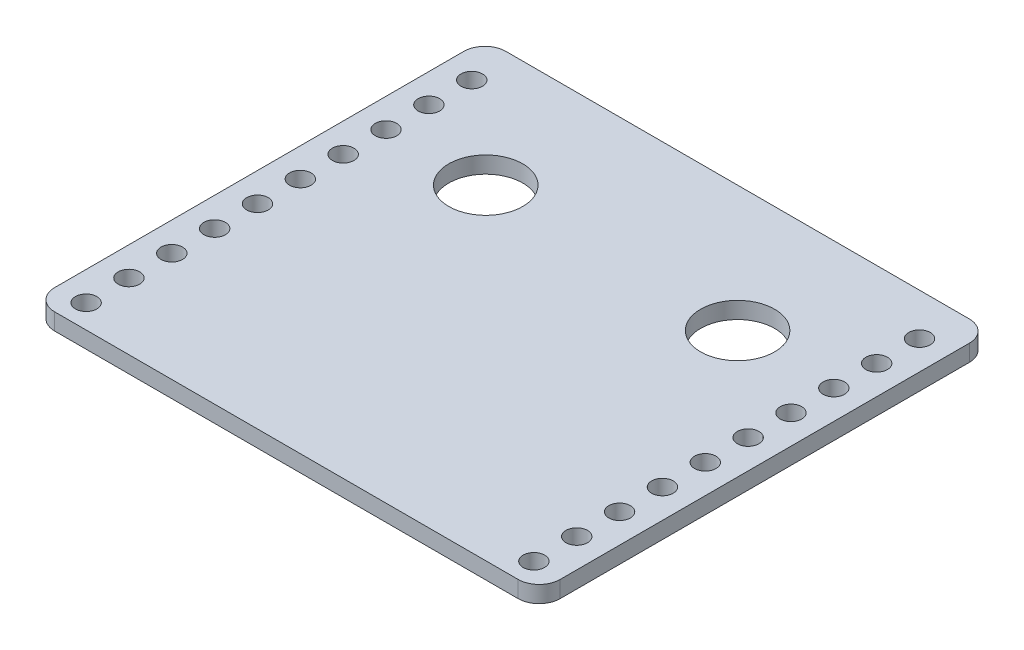
from build123d import *

# Parameters (mm, degrees)
SKETCH1_W           = 96.35
SKETCH1_H           = 86
SKETCH1_R           = 2.05
BOSS_EXTRUDE1_DEPTH = 3.175
FILLET1_R           = 4
SKETCH2_R           = 7.05
CUT_EXTRUDE1_DEPTH  = 3.18


with BuildPart() as part:
    # Sketch1 → Boss-Extrude1 (new body)
    with BuildSketch(Plane(origin=(0, 0, 0), x_dir=(1, 0, 0), z_dir=(0, 1, 0))):
        Rectangle(SKETCH1_W, SKETCH1_H)
        with Locations(Location((42.675, 35, 0), (0, 0, 270))):
            Circle(SKETCH1_R, mode=Mode.SUBTRACT)
        with Locations(Location((42.675, 26.832661921, 0), (0, 0, 270))):
            Circle(SKETCH1_R, mode=Mode.SUBTRACT)
        with Locations(Location((42.675, 18.665323842, 0), (0, 0, 270))):
            Circle(SKETCH1_R, mode=Mode.SUBTRACT)
        with Locations(Location((42.675, 10.497985763, 0), (0, 0, 270))):
            Circle(SKETCH1_R, mode=Mode.SUBTRACT)
        with Locations(Location((42.675, 2.330647684, 0), (0, 0, 270))):
            Circle(SKETCH1_R, mode=Mode.SUBTRACT)
        with Locations(Location((42.675, -5.836690395, 0), (0, 0, 270))):
            Circle(SKETCH1_R, mode=Mode.SUBTRACT)
        with Locations(Location((42.675, -14.004028475, 0), (0, 0, 270))):
            Circle(SKETCH1_R, mode=Mode.SUBTRACT)
        with Locations(Location((42.675, -22.171366554, 0), (0, 0, 270))):
            Circle(SKETCH1_R, mode=Mode.SUBTRACT)
        with Locations(Location((42.675, -30.338704633, 0), (0, 0, 270))):
            Circle(SKETCH1_R, mode=Mode.SUBTRACT)
        with Locations(Location((42.675, -38.506042712, 0), (0, 0, 270))):
            Circle(SKETCH1_R, mode=Mode.SUBTRACT)
        with Locations(Location((-42.675, -38.506042712, 0), (0, 0, 90))):
            Circle(SKETCH1_R, mode=Mode.SUBTRACT)
        with Locations(Location((-42.675, -30.338704633, 0), (0, 0, 90))):
            Circle(SKETCH1_R, mode=Mode.SUBTRACT)
        with Locations(Location((-42.675, -22.171366554, 0), (0, 0, 90))):
            Circle(SKETCH1_R, mode=Mode.SUBTRACT)
        with Locations(Location((-42.675, -14.004028475, 0), (0, 0, 90))):
            Circle(SKETCH1_R, mode=Mode.SUBTRACT)
        with Locations(Location((-42.675, -5.836690395, 0), (0, 0, 90))):
            Circle(SKETCH1_R, mode=Mode.SUBTRACT)
        with Locations(Location((-42.675, 2.330647684, 0), (0, 0, 90))):
            Circle(SKETCH1_R, mode=Mode.SUBTRACT)
        with Locations(Location((-42.675, 10.497985763, 0), (0, 0, 90))):
            Circle(SKETCH1_R, mode=Mode.SUBTRACT)
        with Locations(Location((-42.675, 18.665323842, 0), (0, 0, 90))):
            Circle(SKETCH1_R, mode=Mode.SUBTRACT)
        with Locations(Location((-42.675, 26.832661921, 0), (0, 0, 90))):
            Circle(SKETCH1_R, mode=Mode.SUBTRACT)
        with Locations(Location((-42.675, 35, 0), (0, 0, 90))):
            Circle(SKETCH1_R, mode=Mode.SUBTRACT)
    extrude(amount=BOSS_EXTRUDE1_DEPTH)

    # Fillet1
    fillet1_edges = [part.edges().sort_by_distance(p)[0] for p in [
        (48.175, 1.5875, 43),
        (-48.175, 1.5875, 43),
        (-48.175, 1.5875, -43),
        (48.175, 1.5875, -43),
    ]]
    fillet(fillet1_edges, radius=FILLET1_R)

    # Sketch2 → Cut-Extrude1 (cut)
    with BuildSketch(Plane(origin=(0, 3.175, 0), x_dir=(1, 0, 0), z_dir=(0, 1, 0))):
        with Locations(Location((-24, 19, 0), (0, 0, 270))):
            Circle(SKETCH2_R)
        with Locations(Location((24, 19, 0), (0, 0, 270))):
            Circle(SKETCH2_R)
    extrude(amount=-CUT_EXTRUDE1_DEPTH, mode=Mode.SUBTRACT)


solid = part.part
